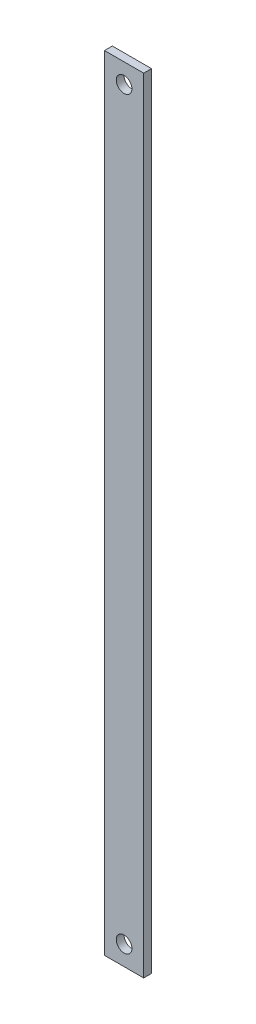
from build123d import *

# Parameters (mm, degrees)
SKETCH1_W           = 10
SKETCH1_H           = 200
SKETCH1_R           = 2
BOSS_EXTRUDE1_DEPTH = 2


with BuildPart() as part:
    # Sketch1 → Boss-Extrude1 (new body)
    with BuildSketch(Plane.XY):
        Rectangle(SKETCH1_W, SKETCH1_H)
        with Locations((0, -95)):
            Circle(SKETCH1_R, mode=Mode.SUBTRACT)
        with Locations(Location((0, 95, 0), (0, 0, 180))):
            Circle(SKETCH1_R, mode=Mode.SUBTRACT)
    extrude(amount=BOSS_EXTRUDE1_DEPTH)


solid = part.part
